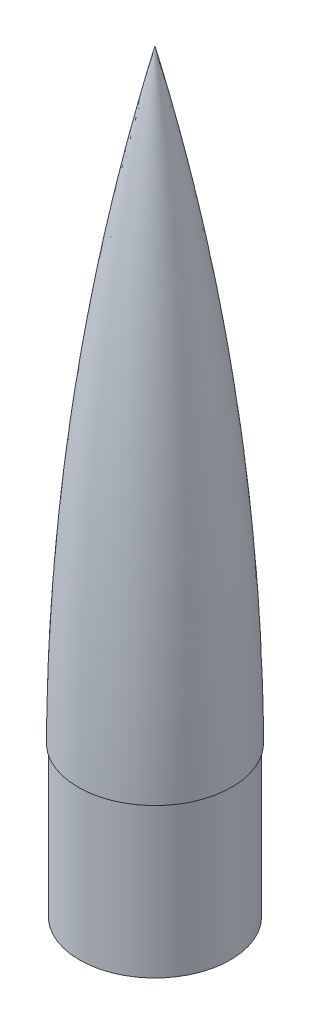
from build123d import *


with BuildPart() as part:
    # Sketch1 → Revolve1 (revolve)
    with BuildSketch(Plane.XY, mode=Mode.PRIVATE) as revolve1_sk:
        with BuildLine():
            ThreePointArc((74.7799876, 151.8793), (55.752781234, 458.227127081), (0, 760.0592876))
            Line((0, 760.0592876), (0, 761.4793))
            ThreePointArc((0, 761.4793), (57.269529862, 459.02974038), (77.6200124, 151.8793))
            Line((77.6200124, 151.8793), (76.2, 151.8793))
            Line((76.2, 151.8793), (76.2, 0))
            Line((76.2, 0), (74.7799876, 0))
            Line((74.7799876, 0), (74.7799876, 151.8793))
        make_face()
    revolve(revolve1_sk.sketch.rotate(Axis((0, 161.723937121, 0), (0, -1, 0)), 90), axis=Axis((0, 161.723937121, 0), (0, -1, 0)))


solid = part.part
